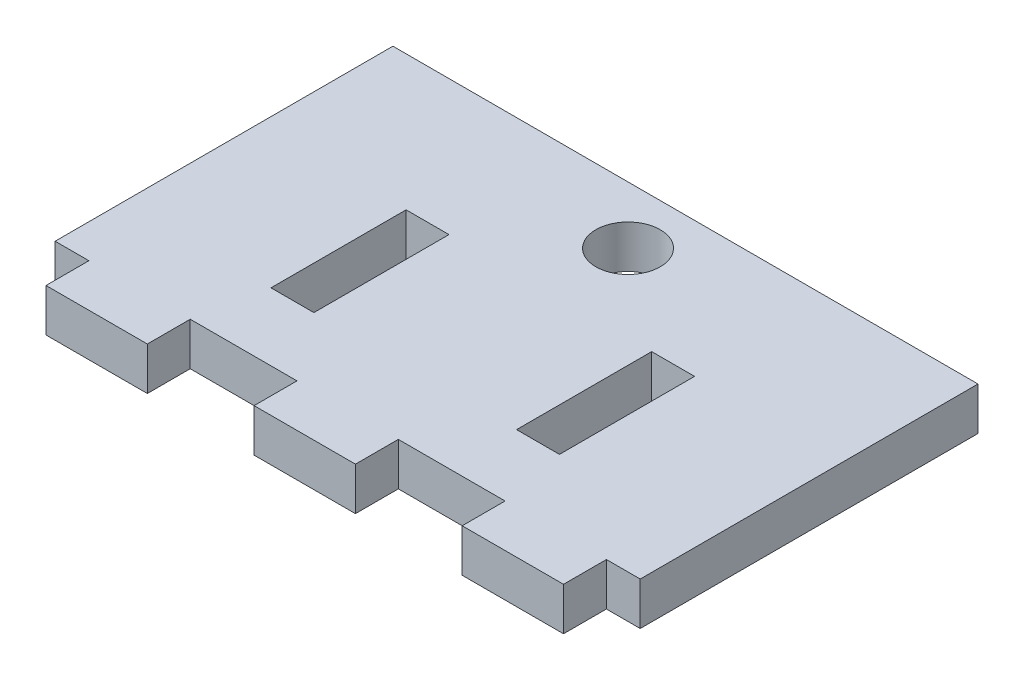
from build123d import *

# Parameters (mm, degrees)
ESQUISSE2_W             = 86.602540378
ESQUISSE2_H             = 50
BOSS_EXTRU_1_DEPTH      = 6.35
SKETCH1_R               = 4.7625
CUT_EXTRUDE1_DEPTH      = 6.35
ESQUISSE3_W             = 15
ESQUISSE3_H             = 6.35
BOSS_EXTRU_2_DEPTH      = 6.35
ESQUISSE4_W             = 6.35
ESQUISSE4_H             = 20
ENL_V_MAT_EXTRU_1_DEPTH = 6.35


with BuildPart() as part:
    # Esquisse2 → Boss.-Extru.1 (new body)
    with BuildSketch(Plane(origin=(0, 0, 0), x_dir=(1, 0, 0), z_dir=(0, 1, 0))):
        Rectangle(ESQUISSE2_W, ESQUISSE2_H)
    extrude(amount=BOSS_EXTRU_1_DEPTH)

    # Sketch1 → Cut-Extrude1 (cut)
    with BuildSketch(Plane(origin=(0, 6.35, 0), x_dir=(1, 0, 0), z_dir=(0, 1, 0))):
        with Locations(Location((0, 16.5, 0), (0, 0, 270))):
            Circle(SKETCH1_R)
    extrude(amount=-CUT_EXTRUDE1_DEPTH, mode=Mode.SUBTRACT)

    # Esquisse3 → Boss.-Extru.2 (add)
    with BuildSketch(Plane.XY.offset(25)):
        with Locations((30.801270189, 3.175)):
            Rectangle(ESQUISSE3_W, ESQUISSE3_H)
        with Locations((-30.801270189, 3.175)):
            Rectangle(ESQUISSE3_W, ESQUISSE3_H)
        with Locations((0, 3.175)):
            Rectangle(ESQUISSE3_W, ESQUISSE3_H)
    extrude(amount=BOSS_EXTRU_2_DEPTH)

    # Esquisse4 → Enlèv. mat.-Extru.1 (cut)
    with BuildSketch(Plane.XZ):
        with Locations((18.175, 5)):
            Rectangle(ESQUISSE4_W, ESQUISSE4_H)
        with Locations((-18.175, 5)):
            Rectangle(ESQUISSE4_W, ESQUISSE4_H)
    extrude(amount=-ENL_V_MAT_EXTRU_1_DEPTH, mode=Mode.SUBTRACT)


solid = part.part
